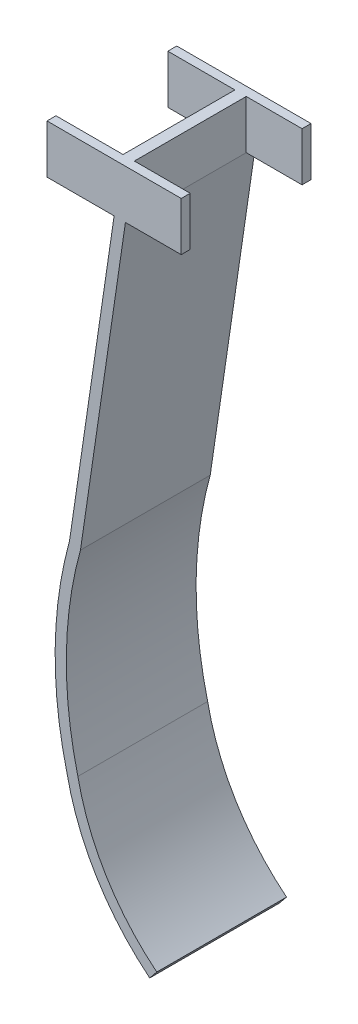
from build123d import *

# Parameters (mm, degrees)
EXTRUDE_1_DEPTH     = 14.5
SKETCH_3_W          = 7.5
SKETCH_3_H          = 12.5
CUT_EXTRUDE_1_DEPTH = 14.5
SKETCH_4_W          = 6.236601739
SKETCH_4_H          = 12.5
CUT_EXTRUDE_2_DEPTH = 14.5


with BuildPart() as part:
    # 草图2 → 凸台-拉伸1 (new body)
    with BuildSketch(Plane.XY):
        Polygon((-37.803253111, 45.788749387), (-30.303253111, 45.788749387), (-30.303253111, 46.246753013), (-30.303253111, 51.227331274), (-45.303253111, 51.227331274), (-45.303253111, 45.788749387), align=None)
        with BuildLine():
            Line((-36.53985485, 45.788749387), (-37.803253111, 45.788749387))
            Line((-37.803253111, 45.788749387), (-42.78903224, 11.827146721))
            ThreePointArc((-42.78903224, 11.827146721), (-44.390022844, 0.555474177), (-43.071585345, -10.752730607))
            ThreePointArc((-43.071585345, -10.752730607), (-39.768948275, -19.163531384), (-33.824827731, -25.969147616))
            Line((-33.824827731, -25.969147616), (-33.037880544, -24.9979555))
            ThreePointArc((-33.037880544, -24.9979555), (-38.707558344, -18.503127277), (-41.852353206, -10.475779938))
            ThreePointArc((-41.852353206, -10.475779938), (-43.139798164, 0.565020843), (-41.563632025, 11.568315655))
            Line((-41.563632025, 11.568315655), (-36.53985485, 45.788749387))
        make_face()
    extrude(amount=EXTRUDE_1_DEPTH)

    # 草图3 → 切除-拉伸1 (cut)
    with BuildSketch(Plane.XZ.offset(-45.788749387)):
        with Locations((-41.553253111, 7.25)):
            Rectangle(SKETCH_3_W, SKETCH_3_H)
    extrude(amount=-CUT_EXTRUDE_1_DEPTH, mode=Mode.SUBTRACT)

    # 草图4 → 切除-拉伸2 (cut)
    with BuildSketch(Plane.XZ.offset(-45.788749387)):
        with Locations((-33.421553981, 7.25)):
            Rectangle(SKETCH_4_W, SKETCH_4_H)
    extrude(amount=-CUT_EXTRUDE_2_DEPTH, mode=Mode.SUBTRACT)


solid = part.part
